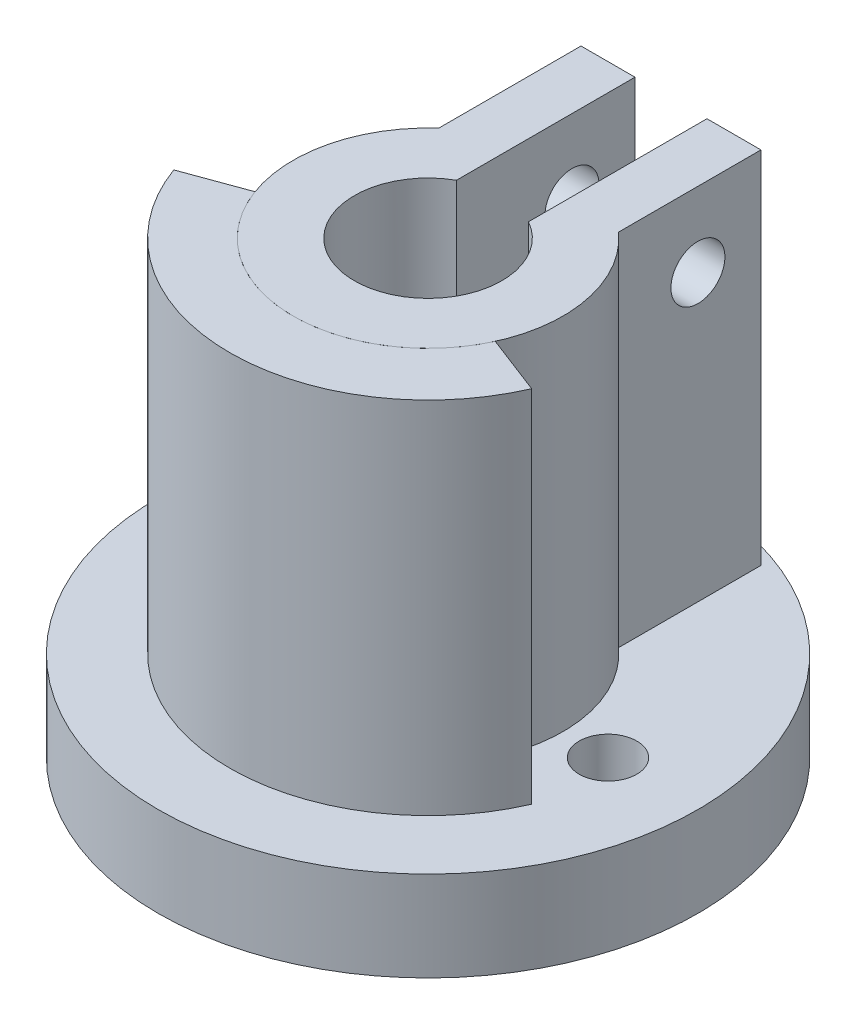
from build123d import *

# Parameters (mm, degrees)
SKETCH_1_R           = 15
EXTRUDE_1_DEPTH      = 5
SKETCH_2_R           = 7.5
SKETCH_2_R_2         = 4.1
EXTRUDE_2_DEPTH      = 20
SKETCH_3_R           = 1.6
CUT_EXTRUDE_1_DEPTH  = 30.154759474
SKETCH_4_R           = 4.1
CUT_EXTRUDE_2_DEPTH  = 30.154759474
CUT_EXTRUDE_3_DEPTH  = 20
EXTRUDE_3_DEPTH      = 3
EXTRUDE_3_DEPTH_BACK = 5
SKETCH_8_R           = 1.5
CUT_EXTRUDE_4_DEPTH  = 36.355339059
EXTRUDE_4_DEPTH      = 20


with BuildPart() as part:
    # 草图1 → 凸台-拉伸1 (new body)
    with BuildSketch(Plane(origin=(0, 0, 0), x_dir=(1, 0, 0), z_dir=(0, 1, 0))):
        with Locations(Location((0, 0, 0), (0, 0, 270))):
            Circle(SKETCH_1_R)
    extrude(amount=EXTRUDE_1_DEPTH)

    # 草图2 → 凸台-拉伸2 (add)
    with BuildSketch(Plane(origin=(0, 5, 0), x_dir=(1, 0, 0), z_dir=(0, 1, 0))):
        with Locations(Location((0, 0, 0), (0, 0, 270))):
            Circle(SKETCH_2_R)
        with Locations(Location((0, 0, 0), (0, 0, 270))):
            Circle(SKETCH_2_R_2, mode=Mode.SUBTRACT)
    extrude(amount=EXTRUDE_2_DEPTH)

    # 草图3 → 切除-拉伸1 (cut, through all)
    with BuildSketch(Plane(origin=(0, 5, 0), x_dir=(1, 0, 0), z_dir=(0, 1, 0))):
        with Locations(Location((10, 0, 0), (0, 0, 270))):
            Circle(SKETCH_3_R)
        with Locations(Location((-10, 0, 0), (0, 0, 270))):
            Circle(SKETCH_3_R)
    extrude(amount=-CUT_EXTRUDE_1_DEPTH, mode=Mode.SUBTRACT)

    # 草图4 → 切除-拉伸2 (cut, through all)
    with BuildSketch(Plane(origin=(0, 5, 0), x_dir=(1, 0, 0), z_dir=(0, 1, 0))):
        with Locations(Location((0, 0, 0), (0, 0, 270))):
            Circle(SKETCH_4_R)
    extrude(amount=-CUT_EXTRUDE_2_DEPTH, mode=Mode.SUBTRACT)

    # 草图5 → 切除-拉伸3 (cut)
    with BuildSketch(Plane.XY):
        Polygon((-2, 30), (2, 30), (2, 5), (0, 5), (-2, 5), align=None)
    extrude(amount=-CUT_EXTRUDE_3_DEPTH, mode=Mode.SUBTRACT)

    # Sketch 3D_1 → 凸台-拉伸3 (add, two sides: drawn at the far end of the back side and taken through both)
    with BuildSketch(Plane(origin=(2, 25, -8.5), x_dir=(-0.3165266866074068, -0.9485836055221155, 0), z_dir=(0, 0, 1)).offset(-EXTRUDE_3_DEPTH_BACK)):
        Polygon((0, 0), (-0.94958006, 2.845750817), (18.30285653, 9.26997102), (19.25243659, 6.424220203), align=None)
        Polygon((1.266106746, -3.794334422), (2.215686806, -6.640085239), (22.11503894, 0), (21.165458881, 2.845750817), align=None)
    extrude(amount=EXTRUDE_3_DEPTH + EXTRUDE_3_DEPTH_BACK)

    # 草图8 → 切除-拉伸4 (cut, through all)
    with BuildSketch(Plane(origin=(5, 0, 0), x_dir=(0, 0, -1), z_dir=(1, 0, 0))):
        with Locations((9.996716615, 20.852388533)):
            Circle(SKETCH_8_R)
    extrude(amount=-CUT_EXTRUDE_4_DEPTH, mode=Mode.SUBTRACT)


with BuildPart() as body_2:
    # 草图13 → 凸台-拉伸4 (new body)
    with BuildSketch(Plane(origin=(0, 25, 0), x_dir=(1, 0, 0), z_dir=(0, 1, 0))):
        with BuildLine():
            ThreePointArc((6.830786983, -3.096828893), (-0.283818878, -7.494627866), (-7.045438558, -2.571341193))
            Line((-7.045438558, -2.571341193), (-10.353112879, -3.778527823))
            ThreePointArc((-10.353112879, -3.778527823), (-0.314852007, -11.016582365), (10.120410637, -4.363657563))
            Line((10.120410637, -4.363657563), (6.830786983, -3.096828893))
        make_face()
    extrude(amount=-EXTRUDE_4_DEPTH)


solid = Compound([part.part, body_2.part])
